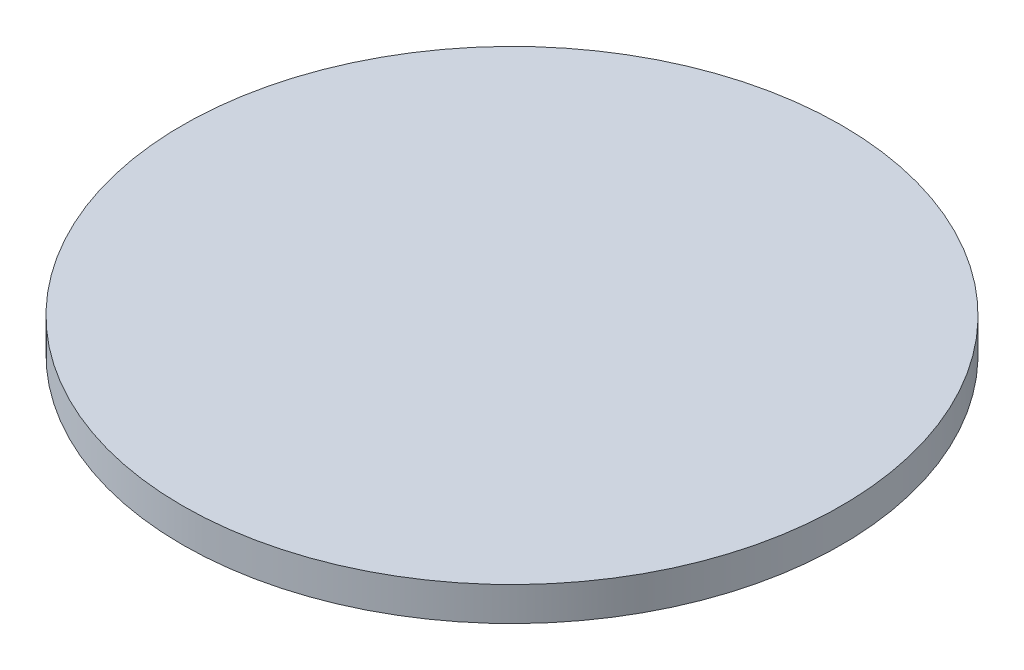
from build123d import *

# Parameters (mm, degrees)
SKETCH1_R           = 49.53
BOSS_EXTRUDE1_DEPTH = 5.08


with BuildPart() as part:
    # Sketch1 → Boss-Extrude1 (new body)
    with BuildSketch(Plane(origin=(0, 0, 0), x_dir=(1, 0, 0), z_dir=(0, 1, 0))):
        with Locations(Location((0, 0, 0), (0, 0, 270))):
            Circle(SKETCH1_R)
    extrude(amount=BOSS_EXTRUDE1_DEPTH)


solid = part.part
